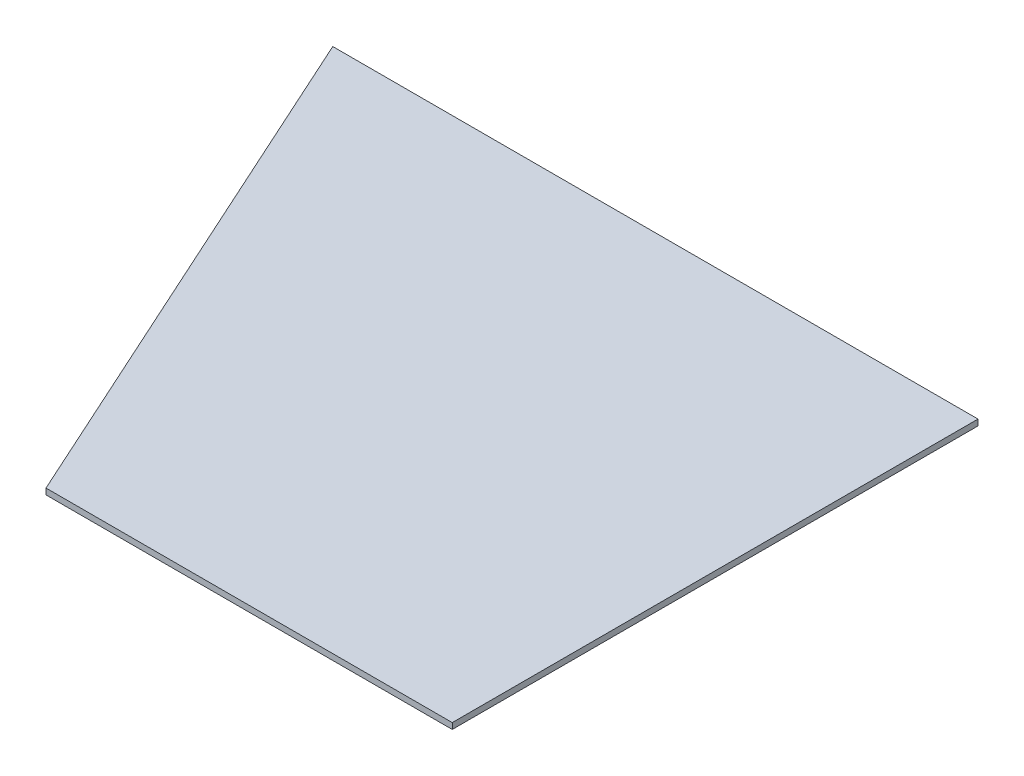
from build123d import *

# Parameters (mm, degrees)
BOSS_EXTRUDE1_DEPTH = 1


with BuildPart() as part:
    # Sketch1 → Boss-Extrude1 (new, symmetric)
    with BuildSketch(Plane(origin=(0, 0, 0), x_dir=(1, 0, 0), z_dir=(0, 1, 0))):
        Polygon((500, 0), (716, 0), (716, -176), (580, -176), align=None)
    extrude(amount=BOSS_EXTRUDE1_DEPTH, both=True)


solid = part.part
